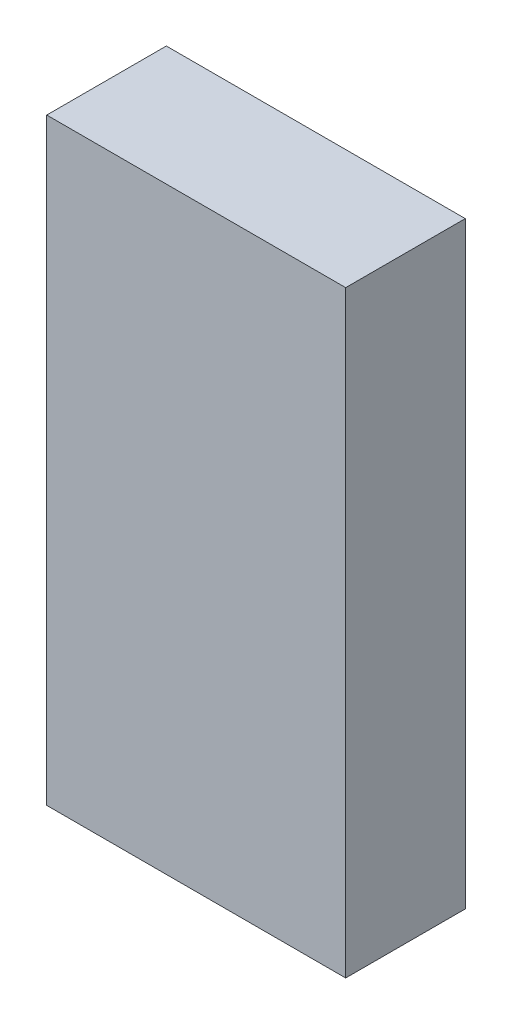
from build123d import *

# Parameters (mm, degrees)
SKETCH1_W           = 10
SKETCH1_H           = 20
BOSS_EXTRUDE1_DEPTH = 4


with BuildPart() as part:
    # Sketch1 → Boss-Extrude1 (new body)
    with BuildSketch(Plane.XY):
        with Locations((5, 10)):
            Rectangle(SKETCH1_W, SKETCH1_H)
    extrude(amount=BOSS_EXTRUDE1_DEPTH)


solid = part.part
